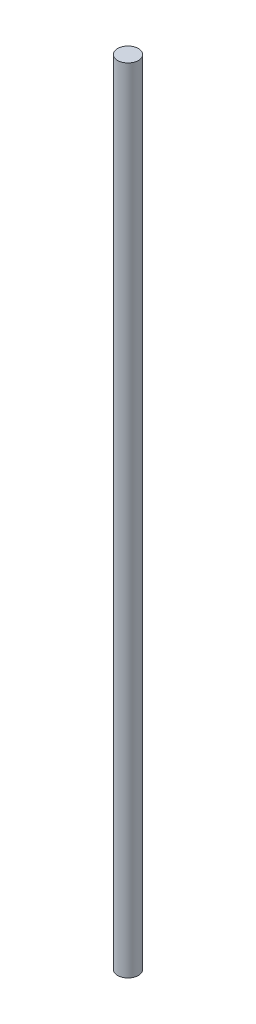
from build123d import *

# Parameters (mm, degrees)
SKETCH1_R           = 4
BOSS_EXTRUDE1_DEPTH = 305


with BuildPart() as part:
    # Sketch1 → Boss-Extrude1 (new body)
    with BuildSketch(Plane(origin=(0, 0, 0), x_dir=(1, 0, 0), z_dir=(0, 1, 0))):
        with Locations(Location((0, 0, 0), (0, 0, 270))):
            Circle(SKETCH1_R)
    extrude(amount=BOSS_EXTRUDE1_DEPTH)


solid = part.part
